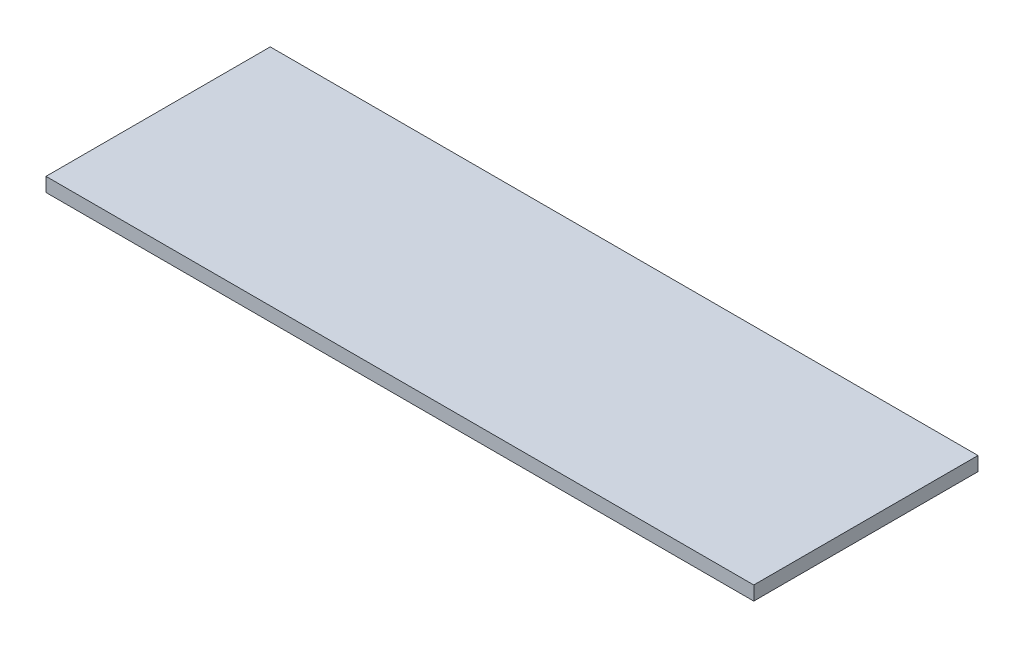
from build123d import *

# Parameters (mm, degrees)
SKETCH1_W           = 641.35
SKETCH1_H           = 203.2
BOSS_EXTRUDE1_DEPTH = 12.7


with BuildPart() as part:
    # Sketch1 → Boss-Extrude1 (new body)
    with BuildSketch(Plane(origin=(0, 0, 0), x_dir=(1, 0, 0), z_dir=(0, 1, 0))):
        with Locations((320.675, 101.6)):
            Rectangle(SKETCH1_W, SKETCH1_H)
    extrude(amount=BOSS_EXTRUDE1_DEPTH)


solid = part.part
